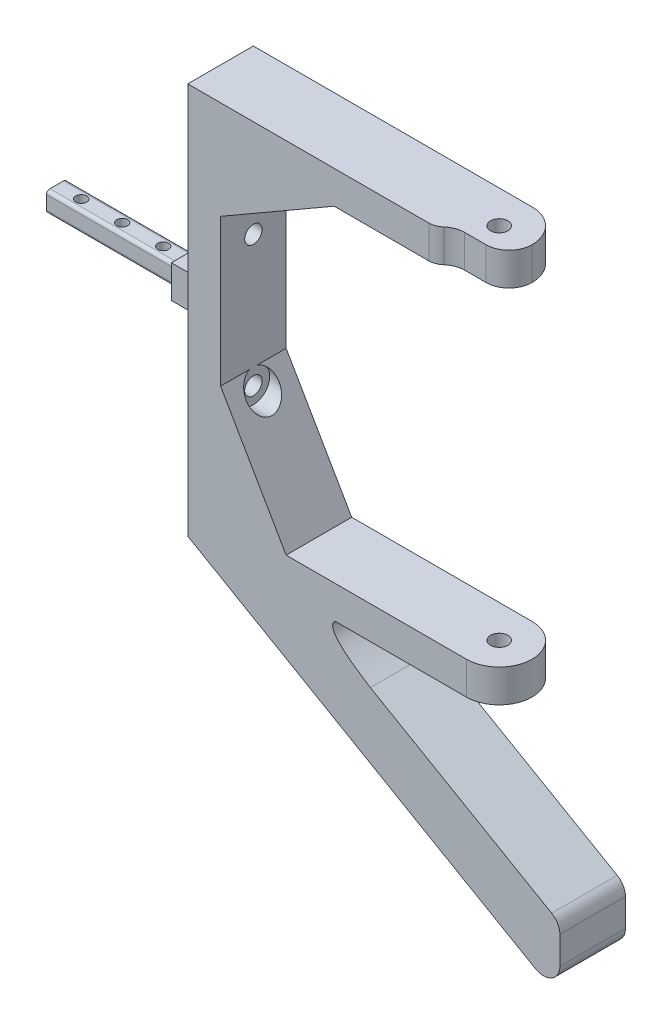
from build123d import *
from OCP.BRepFilletAPI import BRepFilletAPI_MakeChamfer, BRepFilletAPI_MakeFillet

# Parameters (mm, degrees)
EXTRUDE_1_DEPTH     = 20
EXTRUDE_2_DEPTH     = 10
EXTRUDE_START       = 10
EXTRUDE_3_DEPTH     = 40
CUT_EXTRUDE_1_DEPTH = 149.00422291272636
FILLET_1_R          = 1
SKETCH_7_R          = 1.6500000000000021
SKETCH_7_R_2        = 1.6499999999999988
CUT_EXTRUDE_2_DEPTH = 108.57314081591156
CHAMFER_1_SIZE      = 20.000000000000007
CHAMFER_1_SIZE2     = 34.64101615137772
CUT_EXTRUDE_3_REACH = 150.004
FILLET_2_R1         = 5
FILLET_2_R2         = 7
CUT_EXTRUDE_4_REACH = 115.996
CUT_EXTRUDE_START   = -15.710581
CUT_EXTRUDE_5_DEPTH = 5.7105809999999995
BOSS_EXTRUDE1_DEPTH = 20.000000000000004


with BuildPart() as part:
    # 草图1 → 凸台-拉伸1 (new body)
    with BuildSketch(Plane.XY):
        Polygon((-1.953e-14, 49.75), (1.093e-14, -49.75), (85.00000000000001, -49.74999999999995), (85.00000000000001, -59.74999999999995), (-9.999999999999986, -59.74999999999995), (-9.999999999999995, 59.749999999999986), (85, 59.75000000000001), (84.99999999999999, 49.75), align=None)
    extrude(amount=EXTRUDE_1_DEPTH)

    # 草图3 → 凸台-拉伸2 (add)
    # profile 1 of 2: a face of its own
    with BuildSketch(Plane.ZY.offset(9.99999999999999)):
        Polygon((15, 5.000000000000008), (15, -4.999999999999993), (5.000000000000002, -4.999999999999993), (5, 5.000000000000007), align=None)
        Polygon((6.925000000000001, 3.075000000000007), (6.925000000000002, -3.074999999999993), (13.075, -3.074999999999993), (13.075, 3.075000000000007), align=None, mode=Mode.SUBTRACT)
    # profile 2 of 2: a face of its own
    with BuildSketch(Plane.ZY.offset(9.99999999999999)):
        Polygon((6.925000000000001, 3.075000000000007), (13.075, 3.075000000000007), (13.075, -3.074999999999993), (6.925000000000002, -3.074999999999993), align=None)
    extrude(amount=EXTRUDE_2_DEPTH)

    # 草图3<3> → 凸台-拉伸3 (add)
    with BuildSketch(Plane.ZY.offset(9.99999999999999).offset(EXTRUDE_START)):
        Polygon((6.925000000000001, 3.075000000000007), (13.075, 3.075000000000007), (13.075, -3.074999999999993), (6.925000000000002, -3.074999999999993), align=None)
    extrude(amount=EXTRUDE_3_DEPTH)

    # 草图5 → 切除-拉伸1 (cut, through all)
    with BuildSketch(Plane(origin=(-1.309e-14, 59.749999999999986, 0), x_dir=(1, 2.3e-16, 0), z_dir=(-2.3e-16, 1, 0))):
        with BuildLine():
            ThreePointArc((72.34999999999964, -10), (74.99999999999964, -12.65), (77.64999999999965, -10))
            Line((77.64999999999965, -9.99999999999999), (72.34999999999964, -9.999999999999991))
        make_face()
        with BuildLine():
            Line((72.34999999999964, -9.999999999999991), (77.64999999999965, -9.99999999999999))
            ThreePointArc((77.64999999999965, -10), (74.99999999999964, -7.35), (72.34999999999964, -9.999999999999998))
        make_face()
        with BuildLine():
            Line((85.00000000000001, -20), (85.00000000000001, -9.999999999999995))
            ThreePointArc((84.99999999999964, -10.000000000000002), (82.07106781186489, -17.071067811865692), (74.99999999999903, -19.999999999999993))
            Line((74.99999999999903, -20), (85.00000000000001, -20))
        make_face()
        with BuildLine():
            ThreePointArc((74.99999999999908, -5.33e-15), (82.07106781186492, -2.928932188134328), (84.99999999999964, -10))
            Line((85.00000000000001, -9.999999999999995), (85.00000000000001, 0))
            Line((85.00000000000001, 0), (74.99999999999908, 0))
        make_face()
    extrude(amount=-CUT_EXTRUDE_1_DEPTH, mode=Mode.SUBTRACT)

    # 圆角1
    fillet_1_edges = [part.edges().sort_by_distance(p)[0] for p in [
        (-39.999999999999986, -3.0749999999999953, 6.925000000000002),
        (-39.999999999999986, -3.0749999999999953, 13.075),
        (-39.999999999999986, 3.0750000000000046, 13.075),
        (-39.999999999999986, 3.0750000000000046, 6.925000000000001),
    ]]
    fillet(fillet_1_edges, radius=FILLET_1_R)

    # 草图7 → 切除-拉伸2 (cut, through all)
    with BuildSketch(Plane(origin=(-1.6e-16, 3.0750000000000064, 0), x_dir=(1, 5e-17, 0), z_dir=(-5e-17, 1, 0))):
        with Locations(Location((-39.99999999999999, -10, 0), (0, 0, 180))):
            Circle(SKETCH_7_R)
        with Locations(Location((-52.49999999999999, -10.000000000000002, 0), (0, 0, 180))):
            Circle(SKETCH_7_R)
        with Locations(Location((-27.499999999999993, -9.999999999999998, 0), (0, 0, 180))):
            Circle(SKETCH_7_R_2)
    extrude(amount=-CUT_EXTRUDE_2_DEPTH, mode=Mode.SUBTRACT)

    # 倒角1: one chamfer whose edges measure the first distance from different faces: ONE call of the kernel's chamfer builder (chamfer() names one face for all edges)
    chamfer_1_edges_1 = [part.edges().sort_by_distance(p)[0] for p in [
        (-1.953e-14, 49.75, 10),
    ]]
    chamfer_1_side_1 = [part.faces().sort_by_distance(p)[0] for p in [
        (-4.3e-15, -1.94e-15, 10),
    ]]
    chamfer_1_edges_2 = [part.edges().sort_by_distance(p)[0] for p in [
        (1.093e-14, -49.75, 10),
    ]]
    chamfer_1_side_2 = [part.faces().sort_by_distance(p)[0] for p in [
        (41.004447540474715, -49.74999999999998, 9.99999999999999),
    ]]
    chamfer_1 = BRepFilletAPI_MakeChamfer(part.part.solid().wrapped)
    for e in chamfer_1_edges_1:
        chamfer_1.Add(CHAMFER_1_SIZE, CHAMFER_1_SIZE2, e.wrapped, chamfer_1_side_1[0].wrapped)  # the first distance lies on this face
    for e in chamfer_1_edges_2:
        chamfer_1.Add(CHAMFER_1_SIZE, CHAMFER_1_SIZE2, e.wrapped, chamfer_1_side_2[0].wrapped)  # the first distance lies on this face
    add(Compound.cast(chamfer_1.Shape()), mode=Mode.REPLACE)

    # 草图8 → 切除-拉伸3 (cut, up to next)
    with BuildSketch(Plane(origin=(-1.309e-14, 59.749999999999986, 0), x_dir=(1, 2.2e-16, 0), z_dir=(-2.2e-16, 1, 0)), mode=Mode.PRIVATE) as cut_extrude_3_sk1:
        with BuildLine():
            ThreePointArc((74.99999999999964, -20), (78.87298334620706, -19.219544457292884), (82.14142842854251, -16.99999999999999))
            Line((82.14142842854251, -16.999999999999993), (71.47264625833486, -16.999999999999993))
            ThreePointArc((71.47264625833486, -16.999999999999993), (68.23227590913093, -17.795163177004564), (65.72808361179683, -20.000000000000007))
            Line((65.72808361179683, -20), (74.99999999999964, -20))
        make_face()
    cut_extrude_3_tool1 = extrude(cut_extrude_3_sk1.sketch, amount=-CUT_EXTRUDE_3_REACH, mode=Mode.PRIVATE) & part.part
    add(cut_extrude_3_tool1.solids().sort_by_distance((73.723085, 59.75, 18.477053))[0], mode=Mode.SUBTRACT)

    # 圆角2: one fillet with a radius per group of edges: ONE call of the kernel's fillet builder (fillet() takes one radius for all edges)
    fillet_2_edges_1 = [part.edges().sort_by_distance(p)[0] for p in [
        (65.72808361179682, 54.75, 20.000000000000004),
    ]]
    fillet_2_edges_2 = [part.edges().sort_by_distance(p)[0] for p in [
        (82.1414284285425, 54.75, 16.999999999999993),
    ]]
    fillet_2 = BRepFilletAPI_MakeFillet(part.part.solid().wrapped)
    for e in fillet_2_edges_1:
        fillet_2.Add(FILLET_2_R1, e.wrapped)
    for e in fillet_2_edges_2:
        fillet_2.Add(FILLET_2_R2, e.wrapped)
    add(Compound.cast(fillet_2.Shape()), mode=Mode.REPLACE)

    # 草图10 → 切除-拉伸4 (cut, up to next)
    with BuildSketch(Plane.ZY.offset(9.99999999999999), mode=Mode.PRIVATE) as cut_extrude_4_sk1:
        with BuildLine():
            ThreePointArc((12.649999999999984, 20.00000000000003), (11.873832970144308, 21.873832970144406), (9.999999999999908, 22.650000000000027))
            Line((9.999999999999988, 22.650000000000027), (9.999999999999988, 20.00000000000003))
            Line((9.999999999999988, 20.00000000000003), (9.99999999999999, 17.35000000000003))
            ThreePointArc((9.999999999999908, 17.35000000000003), (11.873832970144308, 18.12616702985565), (12.649999999999984, 20.00000000000003))
        make_face()
    cut_extrude_4_tool1 = extrude(cut_extrude_4_sk1.sketch, amount=-CUT_EXTRUDE_4_REACH, mode=Mode.PRIVATE) & part.part
    # 草图10 → 切除-拉伸4 (cut, up to next)
    with BuildSketch(Plane.ZY.offset(9.99999999999999), mode=Mode.PRIVATE) as cut_extrude_4_sk2:
        with BuildLine():
            Line((9.999999999999988, 20.00000000000003), (9.999999999999988, 22.650000000000027))
            ThreePointArc((9.999999999999908, 22.650000000000027), (7.349999999999984, 20.00000000000003), (9.999999999999908, 17.35000000000003))
            Line((9.99999999999999, 17.35000000000003), (9.999999999999988, 20.00000000000003))
        make_face()
    cut_extrude_4_tool2 = extrude(cut_extrude_4_sk2.sketch, amount=-CUT_EXTRUDE_4_REACH, mode=Mode.PRIVATE) & part.part
    # 草图10 → 切除-拉伸4 (cut, up to next)
    with BuildSketch(Plane.ZY.offset(9.99999999999999), mode=Mode.PRIVATE) as cut_extrude_4_sk3:
        with BuildLine():
            ThreePointArc((12.649999999999984, 20.00000000000003), (11.873832970144308, 21.873832970144406), (9.999999999999908, 22.650000000000027))
            Line((9.999999999999988, 22.650000000000027), (9.999999999999988, 20.00000000000003))
            Line((9.999999999999988, 20.00000000000003), (9.99999999999999, 17.35000000000003))
            ThreePointArc((9.999999999999908, 17.35000000000003), (11.873832970144308, 18.12616702985565), (12.649999999999984, 20.00000000000003))
        make_face()
    cut_extrude_4_tool3 = extrude(cut_extrude_4_sk3.sketch, amount=-CUT_EXTRUDE_4_REACH, mode=Mode.PRIVATE) & part.part
    # 草图10 → 切除-拉伸4 (cut, up to next)
    with BuildSketch(Plane.ZY.offset(9.99999999999999), mode=Mode.PRIVATE) as cut_extrude_4_sk4:
        with BuildLine():
            Line((9.999999999999988, 20.00000000000003), (9.999999999999988, 22.650000000000027))
            ThreePointArc((9.999999999999908, 22.650000000000027), (7.349999999999984, 20.00000000000003), (9.999999999999908, 17.35000000000003))
            Line((9.99999999999999, 17.35000000000003), (9.999999999999988, 20.00000000000003))
        make_face()
    cut_extrude_4_tool4 = extrude(cut_extrude_4_sk4.sketch, amount=-CUT_EXTRUDE_4_REACH, mode=Mode.PRIVATE) & part.part
    # 草图10 → 切除-拉伸4 (cut, up to next)
    with BuildSketch(Plane.ZY.offset(9.99999999999999), mode=Mode.PRIVATE) as cut_extrude_4_sk5:
        with BuildLine():
            ThreePointArc((12.649999999999997, -19.99999999999997), (11.873832970144319, -18.12616702985559), (9.999999999999915, -17.349999999999973))
            Line((9.999999999999993, -17.349999999999966), (9.999999999999995, -19.99999999999997))
            Line((9.999999999999995, -19.99999999999997), (9.999999999999995, -22.649999999999977))
            ThreePointArc((9.999999999999917, -22.64999999999997), (11.873832970144319, -21.873832970144353), (12.649999999999997, -19.99999999999997))
        make_face()
    cut_extrude_4_tool5 = extrude(cut_extrude_4_sk5.sketch, amount=-CUT_EXTRUDE_4_REACH, mode=Mode.PRIVATE) & part.part
    # 草图10 → 切除-拉伸4 (cut, up to next)
    with BuildSketch(Plane.ZY.offset(9.99999999999999), mode=Mode.PRIVATE) as cut_extrude_4_sk6:
        with BuildLine():
            Line((9.999999999999995, -19.99999999999997), (9.999999999999993, -17.349999999999966))
            ThreePointArc((9.999999999999915, -17.349999999999973), (7.349999999999996, -19.99999999999997), (9.999999999999917, -22.64999999999997))
            Line((9.999999999999995, -22.649999999999977), (9.999999999999995, -19.99999999999997))
        make_face()
    cut_extrude_4_tool6 = extrude(cut_extrude_4_sk6.sketch, amount=-CUT_EXTRUDE_4_REACH, mode=Mode.PRIVATE) & part.part
    # 草图10 → 切除-拉伸4 (cut, up to next)
    with BuildSketch(Plane.ZY.offset(9.99999999999999), mode=Mode.PRIVATE) as cut_extrude_4_sk7:
        with BuildLine():
            ThreePointArc((12.649999999999997, -19.99999999999997), (11.873832970144319, -18.12616702985559), (9.999999999999915, -17.349999999999973))
            Line((9.999999999999993, -17.349999999999966), (9.999999999999995, -19.99999999999997))
            Line((9.999999999999995, -19.99999999999997), (9.999999999999995, -22.649999999999977))
            ThreePointArc((9.999999999999917, -22.64999999999997), (11.873832970144319, -21.873832970144353), (12.649999999999997, -19.99999999999997))
        make_face()
    cut_extrude_4_tool7 = extrude(cut_extrude_4_sk7.sketch, amount=-CUT_EXTRUDE_4_REACH, mode=Mode.PRIVATE) & part.part
    # 草图10 → 切除-拉伸4 (cut, up to next)
    with BuildSketch(Plane.ZY.offset(9.99999999999999), mode=Mode.PRIVATE) as cut_extrude_4_sk8:
        with BuildLine():
            Line((9.999999999999995, -19.99999999999997), (9.999999999999993, -17.349999999999966))
            ThreePointArc((9.999999999999915, -17.349999999999973), (7.349999999999996, -19.99999999999997), (9.999999999999917, -22.64999999999997))
            Line((9.999999999999995, -22.649999999999977), (9.999999999999995, -19.99999999999997))
        make_face()
    cut_extrude_4_tool8 = extrude(cut_extrude_4_sk8.sketch, amount=-CUT_EXTRUDE_4_REACH, mode=Mode.PRIVATE) & part.part
    add(cut_extrude_4_tool1.solids().sort_by_distance((-10, 20, 11.124695))[0], mode=Mode.SUBTRACT)
    add(cut_extrude_4_tool2.solids().sort_by_distance((-10, 20, 8.875305))[0], mode=Mode.SUBTRACT)
    add(cut_extrude_4_tool3.solids().sort_by_distance((-10, 20, 11.124695))[0], mode=Mode.SUBTRACT)
    add(cut_extrude_4_tool4.solids().sort_by_distance((-10, 20, 8.875305))[0], mode=Mode.SUBTRACT)
    add(cut_extrude_4_tool5.solids().sort_by_distance((-10, -20, 11.124695))[0], mode=Mode.SUBTRACT)
    add(cut_extrude_4_tool6.solids().sort_by_distance((-10, -20, 8.875305))[0], mode=Mode.SUBTRACT)
    add(cut_extrude_4_tool7.solids().sort_by_distance((-10, -20, 11.124695))[0], mode=Mode.SUBTRACT)
    add(cut_extrude_4_tool8.solids().sort_by_distance((-10, -20, 8.875305))[0], mode=Mode.SUBTRACT)

    # 草图10<3> → 切除-拉伸5 (cut)
    with BuildSketch(Plane.ZY.offset(9.99999999999999).offset(CUT_EXTRUDE_START)):
        with BuildLine():
            ThreePointArc((14.999999999999996, -19.99999999999997), (13.535533905932759, -16.46446609406726), (10.000000000000064, -14.999999999999972))
            Line((9.999999999999993, -14.999999999999972), (9.999999999999993, -17.349999999999966))
            ThreePointArc((9.999999999999915, -17.349999999999973), (11.873832970144319, -18.12616702985559), (12.649999999999997, -19.99999999999997))
            ThreePointArc((12.649999999999997, -19.99999999999997), (11.873832970144319, -21.873832970144353), (9.999999999999917, -22.64999999999997))
            Line((9.999999999999995, -22.649999999999977), (9.999999999999995, -24.99999999999997))
            ThreePointArc((10.000000000000057, -24.99999999999997), (13.535533905932756, -23.535533905932688), (14.999999999999996, -19.99999999999997))
        make_face()
        with BuildLine():
            Line((9.999999999999993, -17.349999999999966), (9.999999999999993, -14.999999999999972))
            ThreePointArc((10.000000000000064, -14.999999999999972), (4.999999999999996, -19.999999999999968), (10.000000000000057, -24.99999999999997))
            Line((9.999999999999995, -24.99999999999997), (9.999999999999995, -22.649999999999977))
            ThreePointArc((9.999999999999917, -22.64999999999997), (7.349999999999996, -19.99999999999997), (9.999999999999915, -17.349999999999973))
        make_face()
    extrude(amount=CUT_EXTRUDE_5_DEPTH, mode=Mode.SUBTRACT)

    # Sketch1 → Boss-Extrude1 (add)
    with BuildSketch(Plane.XY.offset(20)):
        with BuildLine():
            Line((-9.999999999999986, -59.74999999999996), (96, -120.94912853410044))
            ThreePointArc((96, -120.94912853410044), (101.00000000000001, -120.94912853410044), (103.50000000000001, -116.61900151517824))
            Line((103.50000000000001, -116.61900151517824), (103.50000000000001, -108.16600689897072))
            ThreePointArc((103.50000000000001, -108.16600689897072), (102.8301270189222, -105.6660068989707), (101, -103.83587988004852))
            Line((101, -103.83587988004852), (45.700950959074255, -71.90895903033973))
            add(Edge.make_bspline(
                [(35.00000000000001, -59.74999999999995), (31.175910828961968, -62.87321170356669), (45.700950959074255, -71.90895903033973)],
                knots=[0, 0, 0, 1, 1, 1], degree=2))
            Line((35.00000000000001, -59.74999999999995), (-9.999999999999986, -59.74999999999996))
        make_face()
    extrude(amount=-BOSS_EXTRUDE1_DEPTH)


solid = part.part
